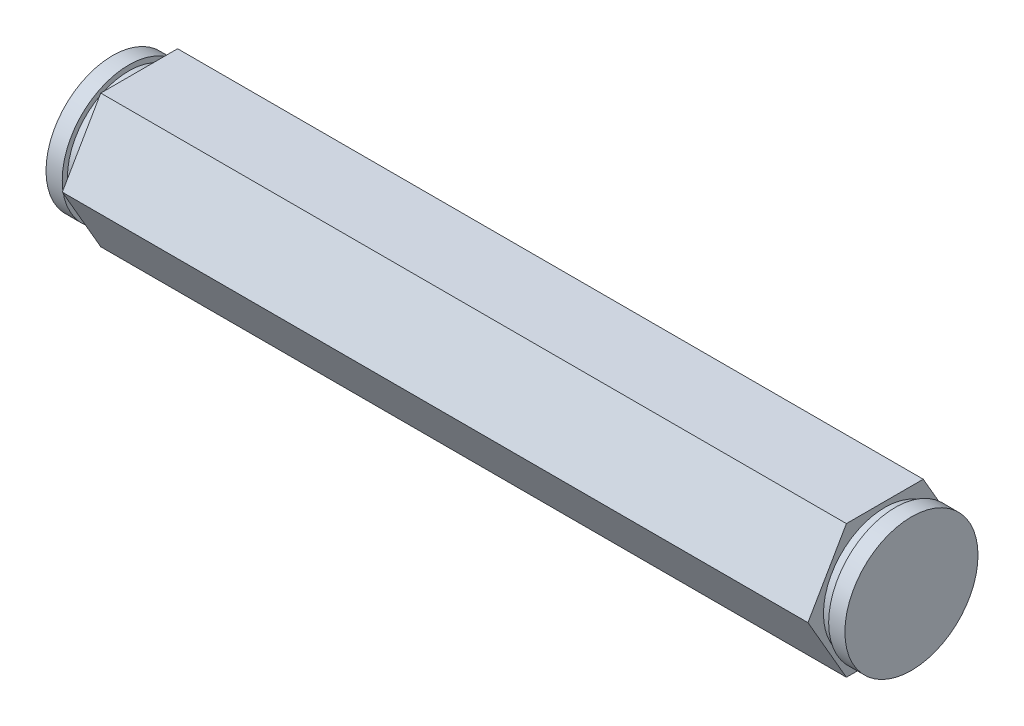
from build123d import *

# Parameters (mm, degrees)
BOSS_EXTRUDE1_DEPTH = 38.11087501


with BuildPart() as part:
    # Sketch1 → Boss-Extrude1 (new, symmetric)
    with BuildSketch(Plane(origin=(0, 0, 0), x_dir=(0, 0, -1), z_dir=(1, 0, 0))):
        Polygon((7.332348419, 0), (3.666174209, 6.35), (-3.666174209, 6.35), (-7.332348419, 0), (-3.666174209, -6.35), (3.666174209, -6.35), align=None)
    extrude(amount=BOSS_EXTRUDE1_DEPTH, both=True)

    # Sketch2 → Cut-Revolve1 (revolve, cut)
    with BuildSketch(Plane(origin=(0, 0, 0), x_dir=(1, 0, 0), z_dir=(0, 1, 0))):
        Polygon((35.57087501, -5.8547), (36.56147501, -5.8547), (36.56147501, -6.35), (38.11087501, -6.35), (38.11087501, -8.89), (35.57087501, -8.89), align=None)
    cut_revolve1 = revolve(axis=Axis((0, 0, 0), (1, 0, 0)), mode=Mode.SUBTRACT)

    # Mirror1: Cut-Revolve1 across plane
    add(cut_revolve1.mirror(Plane(origin=(0, 0, 0), x_dir=(0, 0, 1), z_dir=(1, 0, 0))), mode=Mode.SUBTRACT)


solid = part.part
